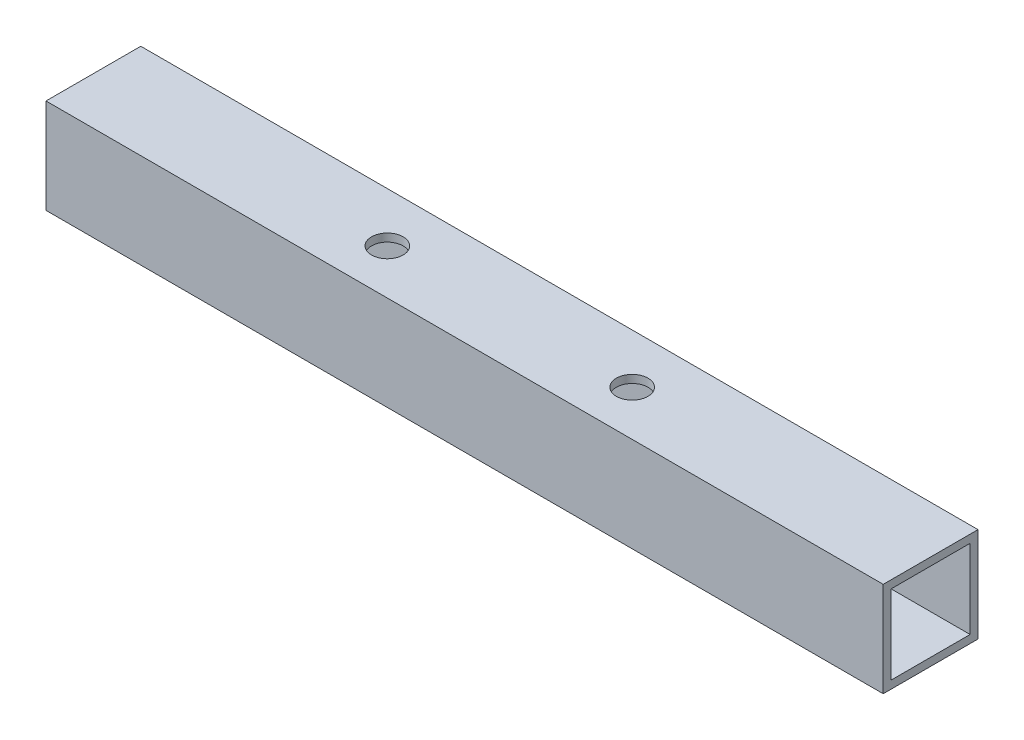
from build123d import *

# Parameters (mm, degrees)
SKETCH1_W           = 106
SKETCH1_H           = 12
BOSS_EXTRUDE1_DEPTH = 12
SKETCH2_R           = 2
CUT_EXTRUDE1_DEPTH  = 12
SKETCH3_W           = 10
SKETCH3_H           = 10
CUT_EXTRUDE2_DEPTH  = 128


with BuildPart() as part:
    # Sketch1 → Boss-Extrude1 (new body)
    with BuildSketch(Plane.XY):
        Rectangle(SKETCH1_W, SKETCH1_H)
    extrude(amount=BOSS_EXTRUDE1_DEPTH)

    # Sketch2 → Cut-Extrude1 (cut)
    with BuildSketch(Plane(origin=(0, 6, 0), x_dir=(1, 0, 0), z_dir=(0, 1, 0))):
        with Locations(Location((-15.5, -6.282258571, 0), (0, 0, 270))):
            Circle(SKETCH2_R)
        with Locations(Location((15.5, -6.282258571, 0), (0, 0, 90))):
            Circle(SKETCH2_R)
    extrude(amount=-CUT_EXTRUDE1_DEPTH, mode=Mode.SUBTRACT)

    # Sketch3 → Cut-Extrude2 (cut)
    with BuildSketch(Plane(origin=(53, 0, 0), x_dir=(0, 0, -1), z_dir=(1, 0, 0))):
        with Locations((-6, 0)):
            Rectangle(SKETCH3_W, SKETCH3_H)
    extrude(amount=-CUT_EXTRUDE2_DEPTH, mode=Mode.SUBTRACT)


solid = part.part
